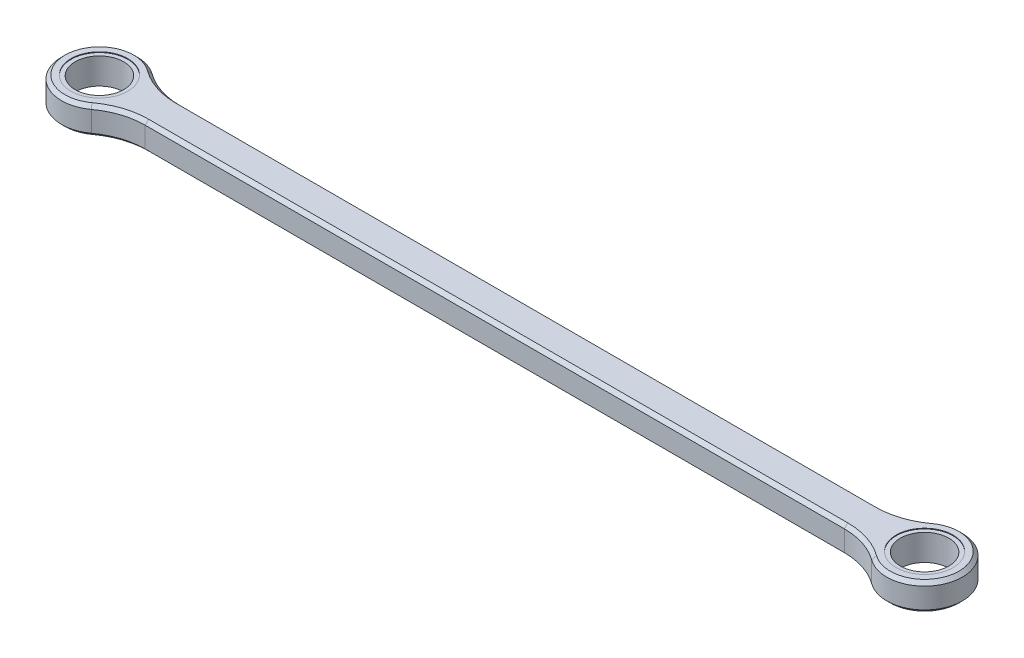
from build123d import *

# Parameters (mm, degrees)
SKETCH_1_R          = 3.525
EXTRUDE_1_DEPTH     = 4
FILLET_1_R          = 10
CHAMFER_1_SIZE      = 0.5
SKETCH_3_R          = 4.125
CUT_EXTRUDE_2_DEPTH = 0.1
CUT_EXTRUDE_START   = -0.1
SKETCH_4_R          = 4.125
CUT_EXTRUDE_3_DEPTH = 0.1


with BuildPart() as part:
    # 草图1 → 凸台-拉伸1 (new body)
    with BuildSketch(Plane(origin=(0, 0, 0), x_dir=(1, 0, 0), z_dir=(0, 1, 0))):
        with BuildLine():
            Line((4.898979486, 2.5), (115.101020514, 2.5))
            ThreePointArc((115.101020514, 2.5), (125.5, 0), (115.101020514, -2.5))
            Line((115.101020514, -2.5), (4.898979486, -2.5))
            ThreePointArc((4.898979486, -2.5), (-5.5, 0), (4.898979486, 2.5))
        make_face()
        with Locations(Location((0, 0, 0), (0, 0, 270))):
            Circle(SKETCH_1_R, mode=Mode.SUBTRACT)
        with Locations(Location((120, 0, 0), (0, 0, 270))):
            Circle(SKETCH_1_R, mode=Mode.SUBTRACT)
    extrude(amount=EXTRUDE_1_DEPTH)

    # 圆角1
    fillet_1_edges = [part.edges().sort_by_distance(p)[0] for p in [
        (4.898979486, 2, -2.5),
        (115.101020514, 2, -2.5),
        (115.101020514, 2, 2.5),
        (4.898979486, 2, 2.5),
    ]]
    fillet(fillet_1_edges, radius=FILLET_1_R)

    # 倒角1
    chamfer_1_edges = [part.edges().sort_by_distance(p)[0] for p in [
        (125.5, 0, 0),
        (125.5, 4, 0),
        (60, 0, 2.5),
        (60, 4, 2.5),
        (60, 0, -2.5),
        (60, 4, -2.5),
        (-5.5, 0, 0),
        (-5.5, 4, 0),
        (113.945703694, 0, 2.996180734),
        (113.945703694, 4, 2.996180734),
        (113.945703694, 0, -2.996180734),
        (113.945703694, 4, -2.996180734),
        (6.054296306, 0, 2.996180734),
        (6.054296306, 4, 2.996180734),
        (6.054296306, 0, -2.996180734),
        (6.054296306, 4, -2.996180734),
    ]]
    chamfer(chamfer_1_edges, length=CHAMFER_1_SIZE)

    # 草图3 → 切除-拉伸2 (cut)
    with BuildSketch(Plane(origin=(0, 4, 0), x_dir=(1, 0, 0), z_dir=(0, 1, 0))):
        with Locations(Location((0, 0, 0), (0, 0, 270))):
            Circle(SKETCH_3_R)
        with Locations(Location((120, 0, 0), (0, 0, 270))):
            Circle(SKETCH_3_R)
    extrude(amount=-CUT_EXTRUDE_2_DEPTH, mode=Mode.SUBTRACT)

    # 草图4 → 切除-拉伸3 (cut)
    with BuildSketch(Plane.XZ.offset(CUT_EXTRUDE_START)):
        with Locations(Location((0, 0, 0), (0, 0, 90))):
            Circle(SKETCH_4_R)
        with Locations(Location((120, 0, 0), (0, 0, 90))):
            Circle(SKETCH_4_R)
    extrude(amount=CUT_EXTRUDE_3_DEPTH, mode=Mode.SUBTRACT)


solid = part.part
